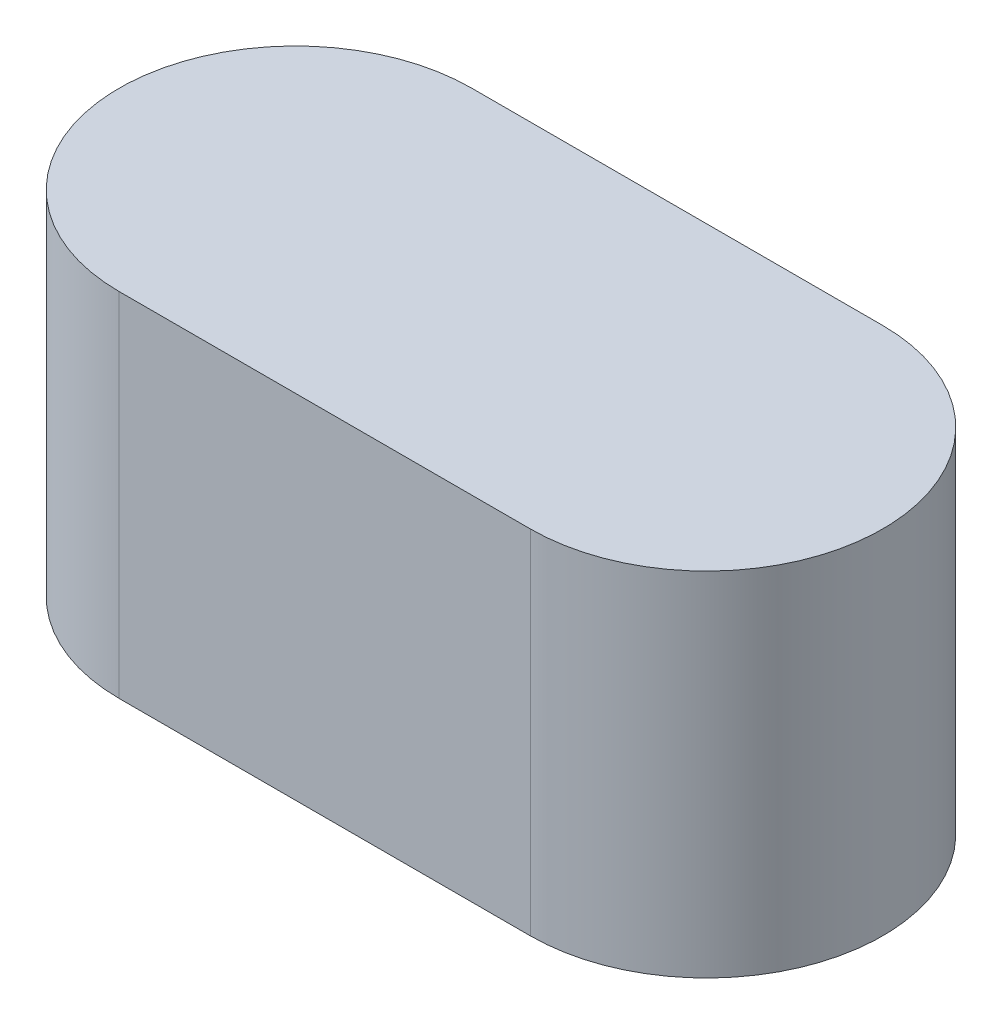
from build123d import *

# Parameters (mm, degrees)
BOSS_EXTRUDE1_DEPTH = 6


with BuildPart() as part:
    # Sketch1 → Boss-Extrude1 (new body)
    with BuildSketch(Plane(origin=(0, 0, 0), x_dir=(1, 0, 0), z_dir=(0, 1, 0))):
        with BuildLine():
            Line((-3.5, -3), (3.5, -3))
            ThreePointArc((3.5, -3), (6.5, 0), (3.5, 3))
            Line((3.5, 3), (-3.5, 3))
            ThreePointArc((-3.5, 3), (-6.5, 0), (-3.5, -3))
        make_face()
    extrude(amount=BOSS_EXTRUDE1_DEPTH)


solid = part.part
